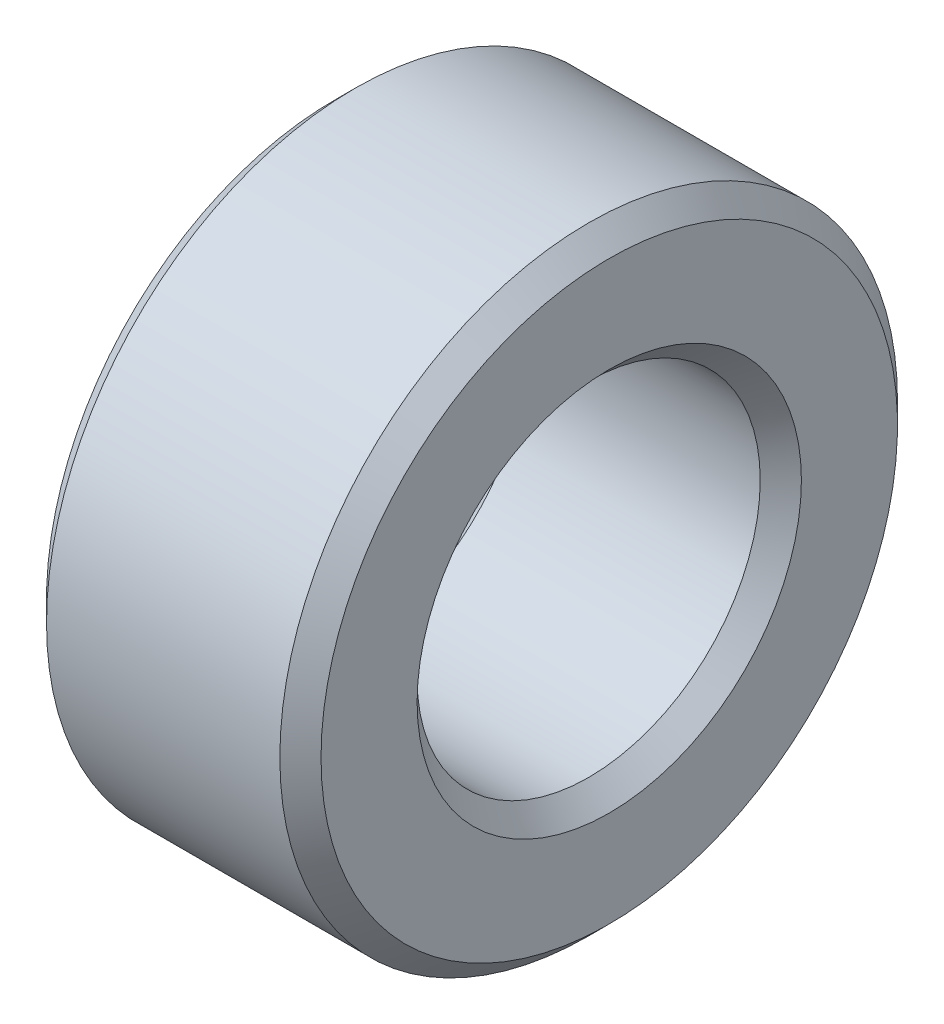
from build123d import *

# Parameters (mm, degrees)
SKICA1_W     = 4
SKICA1_H     = 2
ZKOSIT1_SIZE = 0.3


with BuildPart() as part:
    # Skica1 → Otočit kolem osy1 (revolve)
    with BuildSketch(Plane.XY, mode=Mode.PRIVATE) as oto_it_kolem_osy1_sk:
        with Locations((2, 3.5)):
            Rectangle(SKICA1_W, SKICA1_H)
    revolve(oto_it_kolem_osy1_sk.sketch.rotate(Axis((0, 0, 0), (1, 0, 0)), 90), axis=Axis((0, 0, 0), (1, 0, 0)))

    # Zkosit1
    zkosit1_edges = [part.edges().sort_by_distance(p)[0] for p in [
        (0, 0, -4.5),
        (4, 0, -4.5),
        (4, 0, -2.5),
        (0, 0, -2.5),
    ]]
    chamfer(zkosit1_edges, length=ZKOSIT1_SIZE)


solid = part.part
